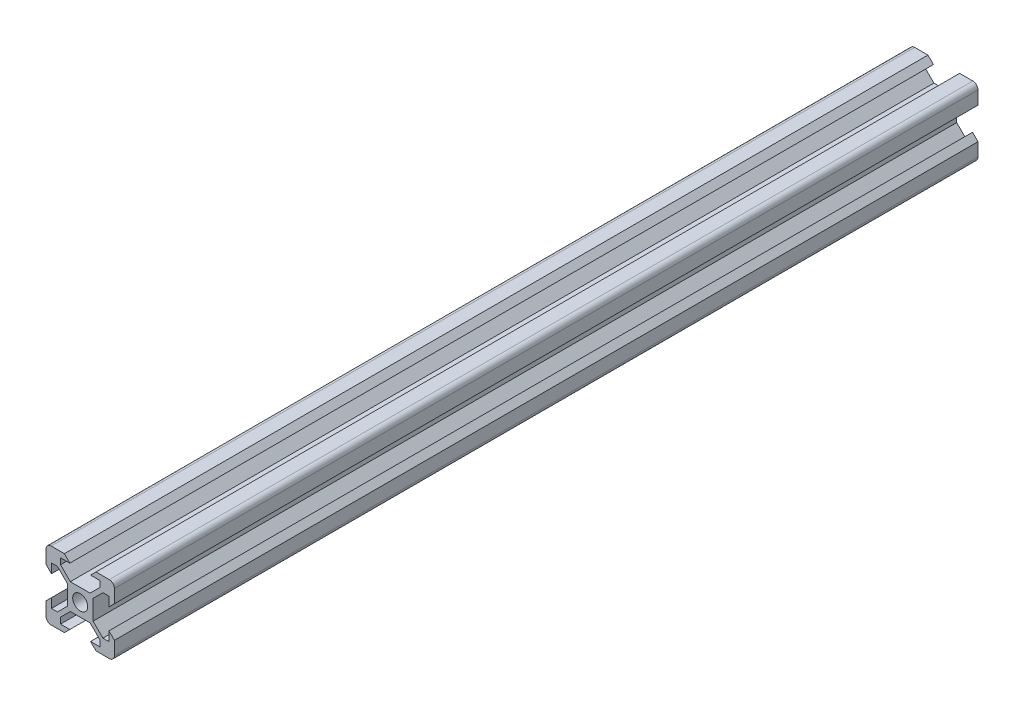
from build123d import *

# Parameters (mm, degrees)
SKETCH1_W           = 15.088
SKETCH1_H           = 15.088
SKETCH1_R           = 4.4
BOSS_EXTRUDE1_DEPTH = 252.5


with BuildPart() as part:
    # Sketch1 → Boss-Extrude1 (new, symmetric)
    # profile 1 of 5: a face of its own
    with BuildSketch(Plane.XY):
        with BuildLine():
            Line((-7.544, 7.544), (-5.784718328, 7.544))
            Line((-5.784718328, 7.544), (-11.512, 13.271281672))
            Line((-11.512, 13.271281672), (-11.512, 16.8))
            Line((-11.512, 16.8), (-6.051976926, 16.8))
            Line((-6.051976926, 16.8), (-9.251976926, 20))
            Line((-9.251976926, 20), (-17, 20))
            ThreePointArc((-17, 20), (-19.121320344, 19.121320344), (-20, 17))
            Line((-20, 17), (-20, 9.251976926))
            Line((-20, 9.251976926), (-16.8, 6.051976926))
            Line((-16.8, 6.051976926), (-16.8, 11.512))
            Line((-16.8, 11.512), (-13.271281672, 11.512))
            Line((-13.271281672, 11.512), (-7.544, 5.784718328))
            Line((-7.544, 5.784718328), (-7.544, 7.544))
        make_face()
    # profile 2 of 5: a face of its own
    with BuildSketch(Plane.XY):
        with BuildLine():
            Line((11.512, 13.271281672), (5.784718328, 7.544))
            Line((5.784718328, 7.544), (7.544, 7.544))
            Line((7.544, 7.544), (7.544, 5.784718328))
            Line((7.544, 5.784718328), (13.271281672, 11.512))
            Line((13.271281672, 11.512), (16.8, 11.512))
            Line((16.8, 11.512), (16.8, 6.051976926))
            Line((16.8, 6.051976926), (20, 9.251976926))
            Line((20, 9.251976926), (20, 17))
            ThreePointArc((20, 17), (19.121320344, 19.121320344), (17, 20))
            Line((17, 20), (9.251976926, 20))
            Line((9.251976926, 20), (6.051976926, 16.8))
            Line((6.051976926, 16.8), (11.512, 16.8))
            Line((11.512, 16.8), (11.512, 13.271281672))
        make_face()
    # profile 3 of 5: a face of its own
    with BuildSketch(Plane.XY):
        with BuildLine():
            Line((-7.544, -7.544), (-7.544, -5.784718328))
            Line((-7.544, -5.784718328), (-13.271281672, -11.512))
            Line((-13.271281672, -11.512), (-16.8, -11.512))
            Line((-16.8, -11.512), (-16.8, -6.051976926))
            Line((-16.8, -6.051976926), (-20, -9.251976926))
            Line((-20, -9.251976926), (-20, -17))
            ThreePointArc((-20, -17), (-19.121320344, -19.121320344), (-17, -20))
            Line((-17, -20), (-9.251976926, -20))
            Line((-9.251976926, -20), (-6.051976926, -16.8))
            Line((-6.051976926, -16.8), (-11.512, -16.8))
            Line((-11.512, -16.8), (-11.512, -13.271281672))
            Line((-11.512, -13.271281672), (-5.784718328, -7.544))
            Line((-5.784718328, -7.544), (-7.544, -7.544))
        make_face()
    # profile 4 of 5: a face of its own
    with BuildSketch(Plane.XY):
        with BuildLine():
            Line((13.271281672, -11.512), (7.544, -5.784718328))
            Line((7.544, -5.784718328), (7.544, -7.544))
            Line((7.544, -7.544), (5.784718328, -7.544))
            Line((5.784718328, -7.544), (11.512, -13.271281672))
            Line((11.512, -13.271281672), (11.512, -16.8))
            Line((11.512, -16.8), (6.051976926, -16.8))
            Line((6.051976926, -16.8), (9.251976926, -20))
            Line((9.251976926, -20), (17, -20))
            ThreePointArc((17, -20), (19.121320344, -19.121320344), (20, -17))
            Line((20, -17), (20, -9.251976926))
            Line((20, -9.251976926), (16.8, -6.051976926))
            Line((16.8, -6.051976926), (16.8, -11.512))
            Line((16.8, -11.512), (13.271281672, -11.512))
        make_face()
    # profile 5 of 5: a face of its own
    with BuildSketch(Plane.XY):
        Rectangle(SKETCH1_W, SKETCH1_H)
        Circle(SKETCH1_R, mode=Mode.SUBTRACT)
    extrude(amount=BOSS_EXTRUDE1_DEPTH, both=True)


solid = part.part
